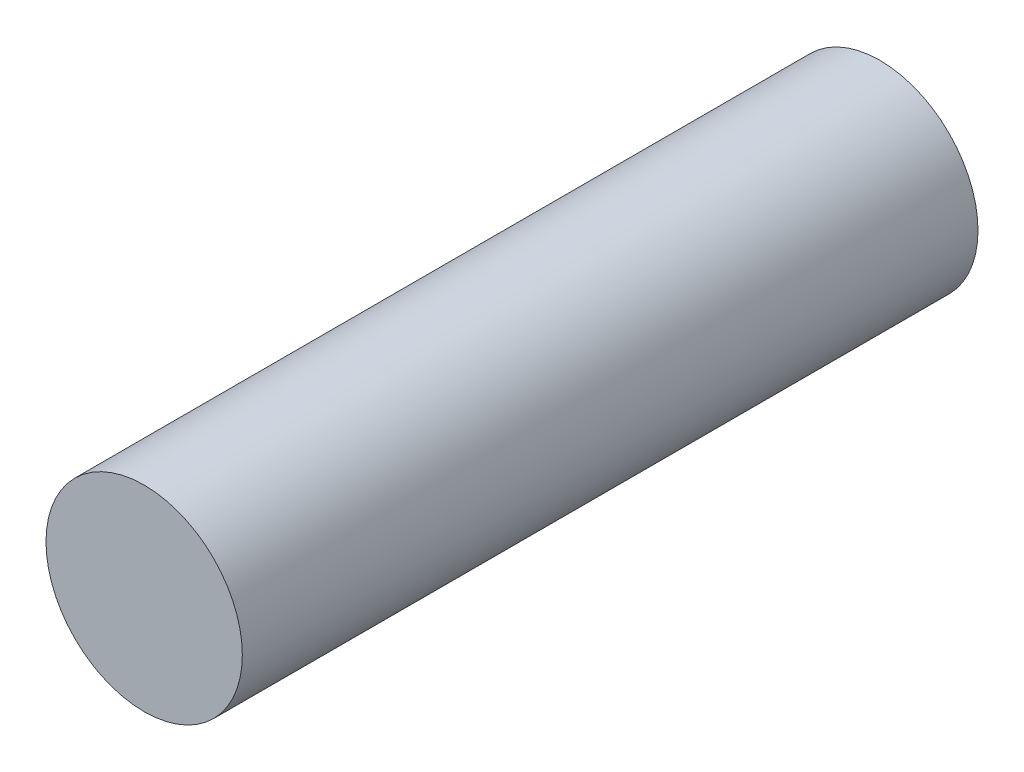
from build123d import *

# Parameters (mm, degrees)
SKETCH1_R           = 50.8381
BOSS_EXTRUDE1_DEPTH = 381


with BuildPart() as part:
    # Sketch1 → Boss-Extrude1 (new body)
    with BuildSketch(Plane.XY):
        Circle(SKETCH1_R)
    extrude(amount=BOSS_EXTRUDE1_DEPTH)


solid = part.part
